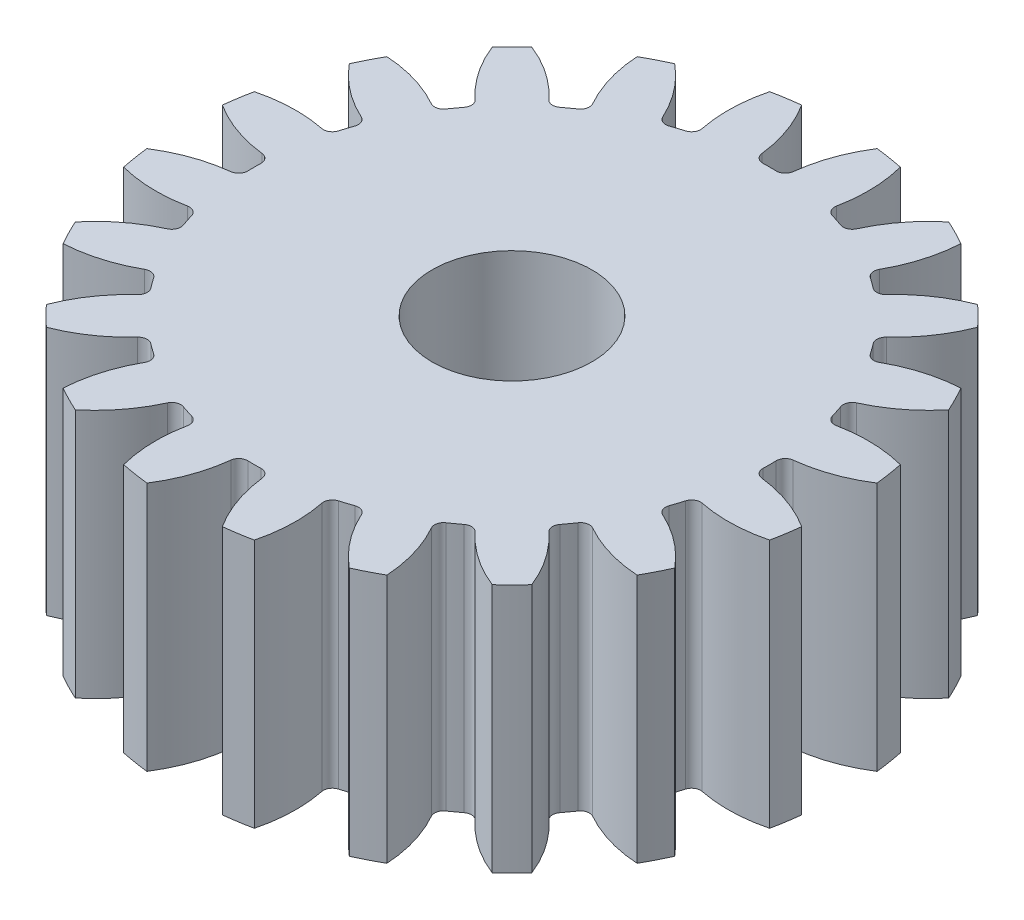
from build123d import *

# Parameters (mm, degrees)
SKIZZE1_R                       = 6.6
SKIZZE1_R_2                     = 6
SKIZZE1_R_3                     = 5.16
SKIZZE1_R_4                     = 1.6
AUFSATZ_LINEAR_AUSTRAGEN1_DEPTH = 5
SCHNITT_LINEAR_AUSTRAGEN1_DEPTH = 11.588673194
VERRUNDUNG1_R                   = 0.18
KREISMUSTER1_COUNT              = 20
VERRUNDUNG1_OF_KREISMUSTER1_R   = 0.18


with BuildPart() as part:
    # Skizze1 → Aufsatz-Linear austragen1 (new body)
    # profile 1 of 3: a face of its own
    with BuildSketch(Plane(origin=(0, 0, 0), x_dir=(1, 0, 0), z_dir=(0, 1, 0))):
        with Locations(Location((0, 0, 0), (0, 0, 270))):
            Circle(SKIZZE1_R)
        Circle(SKIZZE1_R_2, mode=Mode.SUBTRACT)
    # profile 2 of 3: a face of its own
    with BuildSketch(Plane(origin=(0, 0, 0), x_dir=(1, 0, 0), z_dir=(0, 1, 0))):
        Circle(SKIZZE1_R_2)
        Circle(SKIZZE1_R_3, mode=Mode.SUBTRACT)
    # profile 3 of 3: a face of its own
    with BuildSketch(Plane(origin=(0, 0, 0), x_dir=(1, 0, 0), z_dir=(0, 1, 0))):
        Circle(SKIZZE1_R_3)
        with Locations(Location((0, 0, 0), (0, 0, 270))):
            Circle(SKIZZE1_R_4, mode=Mode.SUBTRACT)
    extrude(amount=AUFSATZ_LINEAR_AUSTRAGEN1_DEPTH)

    # Skizze2 → Schnitt-Linear austragen1 (cut, through all)
    with BuildSketch(Plane(origin=(0, 5, 0), x_dir=(1, 0, 0), z_dir=(0, 1, 0))):
        with BuildLine():
            ThreePointArc((-0.884105045, 6.742281385), (-0.473900419, 5.990105194), (-0.299386591, 5.151307375))
            ThreePointArc((-0.299386591, 5.151307375), (0, 5.16), (0.299386591, 5.151307375))
            ThreePointArc((0.299386591, 5.151307375), (0.473900419, 5.990105194), (0.884105045, 6.742281385))
            ThreePointArc((0.884105045, 6.742281385), (0, 6.8), (-0.884105045, 6.742281385))
        make_face()
    schnitt_linear_austragen1 = extrude(amount=-SCHNITT_LINEAR_AUSTRAGEN1_DEPTH, mode=Mode.SUBTRACT)

    # Verrundung1
    verrundung1_edges = [part.edges().sort_by_distance(p)[0] for p in [
        (-0.299386591, 2.5, -5.151307375),
        (0.299386591, 2.5, -5.151307375),
    ]]
    fillet(verrundung1_edges, radius=VERRUNDUNG1_R)

    # Kreismuster1: Schnitt-Linear austragen1 ×20 about axis
    kreismuster1_axis = Axis((0, 0, 0), (0, 1, 0))
    for i in range(1, KREISMUSTER1_COUNT):
        add(schnitt_linear_austragen1.rotate(kreismuster1_axis, i * 360 / KREISMUSTER1_COUNT), mode=Mode.SUBTRACT)

    # Verrundung1 of Kreismuster1
    verrundung1_of_kreismuster1_edges = [part.edges().sort_by_distance(p)[0] for p in [
        (-1.87657509, 2.5, -4.806668902),
        (-1.307107954, 2.5, -4.991699991),
        (-3.270071345, 2.5, -3.991520187),
        (-2.785653665, 2.5, -4.343470232),
        (-4.343470232, 2.5, -2.785653665),
        (-3.991520187, 2.5, -3.270071345),
        (-4.991699991, 2.5, -1.307107954),
        (-4.806668902, 2.5, -1.87657509),
        (-5.151307375, 2.5, 0.299386591),
        (-5.151307375, 2.5, -0.299386591),
        (-4.806668902, 2.5, 1.87657509),
        (-4.991699991, 2.5, 1.307107954),
        (-3.991520187, 2.5, 3.270071345),
        (-4.343470232, 2.5, 2.785653665),
        (-2.785653665, 2.5, 4.343470232),
        (-3.270071345, 2.5, 3.991520187),
        (-1.307107954, 2.5, 4.991699991),
        (-1.87657509, 2.5, 4.806668902),
        (0.299386591, 2.5, 5.151307375),
        (-0.299386591, 2.5, 5.151307375),
        (1.87657509, 2.5, 4.806668902),
        (1.307107954, 2.5, 4.991699991),
        (3.270071345, 2.5, 3.991520187),
        (2.785653665, 2.5, 4.343470232),
        (4.343470232, 2.5, 2.785653665),
        (3.991520187, 2.5, 3.270071345),
        (4.991699991, 2.5, 1.307107954),
        (4.806668902, 2.5, 1.87657509),
        (5.151307375, 2.5, -0.299386591),
        (5.151307375, 2.5, 0.299386591),
        (4.806668902, 2.5, -1.87657509),
        (4.991699991, 2.5, -1.307107954),
        (3.991520187, 2.5, -3.270071345),
        (4.343470232, 2.5, -2.785653665),
        (2.785653665, 2.5, -4.343470232),
        (3.270071345, 2.5, -3.991520187),
        (1.307107954, 2.5, -4.991699991),
        (1.87657509, 2.5, -4.806668902),
    ]]
    fillet(verrundung1_of_kreismuster1_edges, radius=VERRUNDUNG1_OF_KREISMUSTER1_R)


solid = part.part
